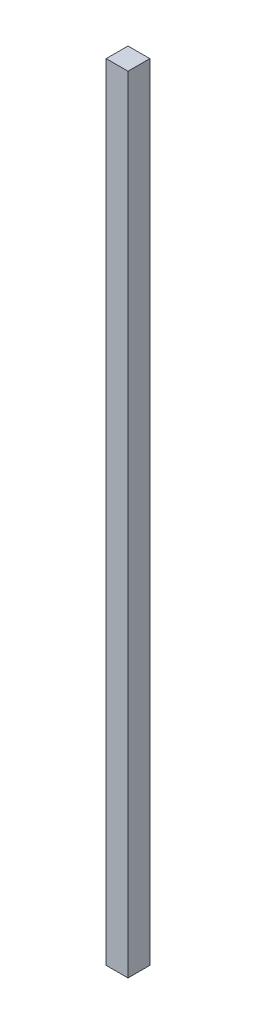
from build123d import *

# Parameters (mm, degrees)
SKETCH1_W           = 25.4
SKETCH1_H           = 914.4
BOSS_EXTRUDE1_DEPTH = 25.4


with BuildPart() as part:
    # Sketch1 → Boss-Extrude1 (new body)
    with BuildSketch(Plane(origin=(0, 0, 0), x_dir=(0, 0, -1), z_dir=(1, 0, 0))):
        Rectangle(SKETCH1_W, SKETCH1_H)
    extrude(amount=BOSS_EXTRUDE1_DEPTH)


solid = part.part
